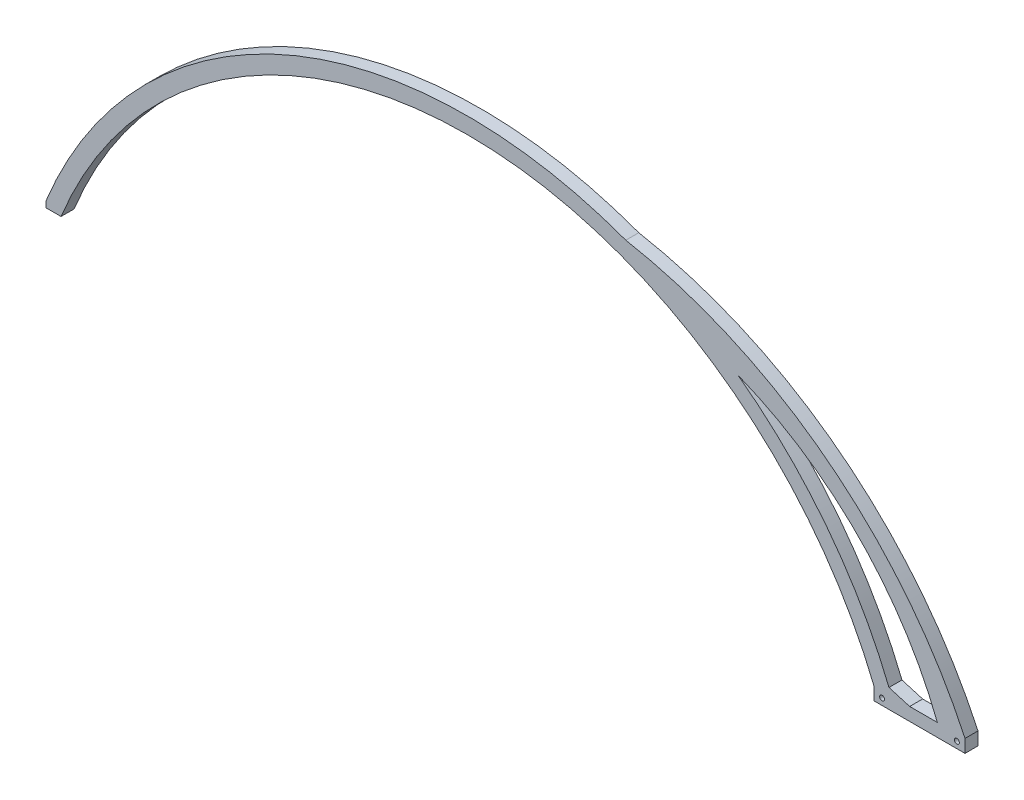
from build123d import *

# Parameters (mm, degrees)
SKETCH_1_W      = 56.1
SKETCH_1_H      = 8
SKETCH_1_R      = 1.5
EXTRUDE_1_DEPTH = 8
EXTRUDE_5_DEPTH = 8
EXTRUDE_6_DEPTH = 8


with BuildPart() as part:
    # 草图1 → 凸台-拉伸1 (new body)
    with BuildSketch(Plane.XY):
        with Locations((28.05, -4)):
            Rectangle(SKETCH_1_W, SKETCH_1_H)
        with Locations((5, -4)):
            Circle(SKETCH_1_R, mode=Mode.SUBTRACT)
        with Locations(Location((51.1, -4, 0), (0, 0, 180))):
            Circle(SKETCH_1_R, mode=Mode.SUBTRACT)
    extrude(amount=EXTRUDE_1_DEPTH)

    # 草图3 → 凸台-拉伸5 (add)
    with BuildSketch(Plane(origin=(0, 0, 0), x_dir=(-1, 0, 0), z_dir=(0, 0, -1))):
        with BuildLine():
            Line((-9.271136129, 3.747804008), (-22.014574203, 0))
            Line((-22.014574203, 0), (0, 0))
            ThreePointArc((0, 0), (250.320675472, 168.809291774), (500.641350944, 0))
            Line((500.641350944, 0), (509.912487072, 0))
            Line((509.912487072, 0), (509.912487072, 3.747804008))
            ThreePointArc((509.912487072, 3.747804008), (250.320675472, 178.809291774), (-9.271136129, 3.747804008))
        make_face()
    extrude(amount=-EXTRUDE_5_DEPTH)

    # 草图4 → 凸台-拉伸6 (add)
    with BuildSketch(Plane(origin=(0, 0, 0), x_dir=(-1, 0, 0), z_dir=(0, 0, -1))):
        with BuildLine():
            ThreePointArc((152.808242493, 161.280862452), (28.754408722, 106.028077563), (-56.1, 0))
            Line((-56.1, 0), (-39.057287102, 0))
            ThreePointArc((-39.057287102, 0), (9.399846723, 74.751796663), (83.727278113, 123.857375428))
            ThreePointArc((83.727278113, 123.857375428), (116.948632862, 145.004129758), (152.808242493, 161.280862452))
        make_face()
    extrude(amount=-EXTRUDE_6_DEPTH)


solid = part.part
